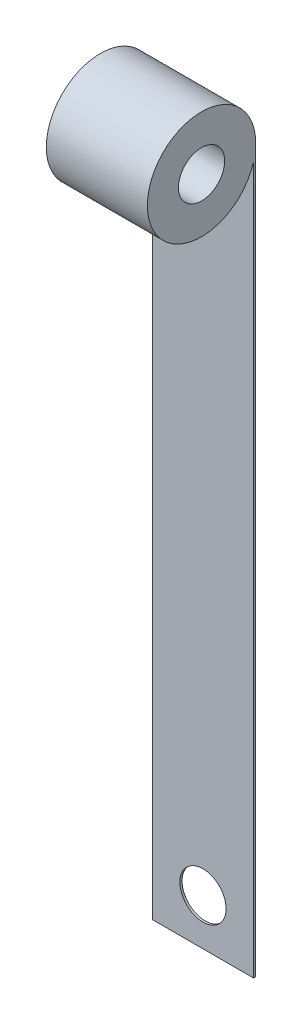
from build123d import *

# Parameters (mm, degrees)
SKETCH_1_R          = 3.75
SKETCH_1_R_2        = 1.6
EXTRUDE_1_DEPTH     = 7
SKETCH_2_W          = 7
SKETCH_2_H          = 0.15
EXTRUDE_2_DEPTH     = 50
SKETCH_3_R          = 1.6
CUT_EXTRUDE_1_DEPTH = 52.019824578


with BuildPart() as part:
    # 草图1 → 凸台-拉伸1 (new body)
    with BuildSketch(Plane(origin=(0, 0, 0), x_dir=(0, 0, -1), z_dir=(1, 0, 0))):
        Circle(SKETCH_1_R)
        Circle(SKETCH_1_R_2, mode=Mode.SUBTRACT)
    extrude(amount=EXTRUDE_1_DEPTH)

    # 草图2 → 凸台-拉伸2 (add)
    with BuildSketch(Plane(origin=(0, 0, 0), x_dir=(1, 0, 0), z_dir=(0, 1, 0))):
        with Locations((3.5, 3.675)):
            Rectangle(SKETCH_2_W, SKETCH_2_H)
    extrude(amount=-EXTRUDE_2_DEPTH)

    # 草图3 → 切除-拉伸1 (cut, through all)
    with BuildSketch(Plane.XY.offset(-3.6)):
        with Locations((3.5, -46.8)):
            Circle(SKETCH_3_R)
    extrude(amount=-CUT_EXTRUDE_1_DEPTH, mode=Mode.SUBTRACT)


solid = part.part
